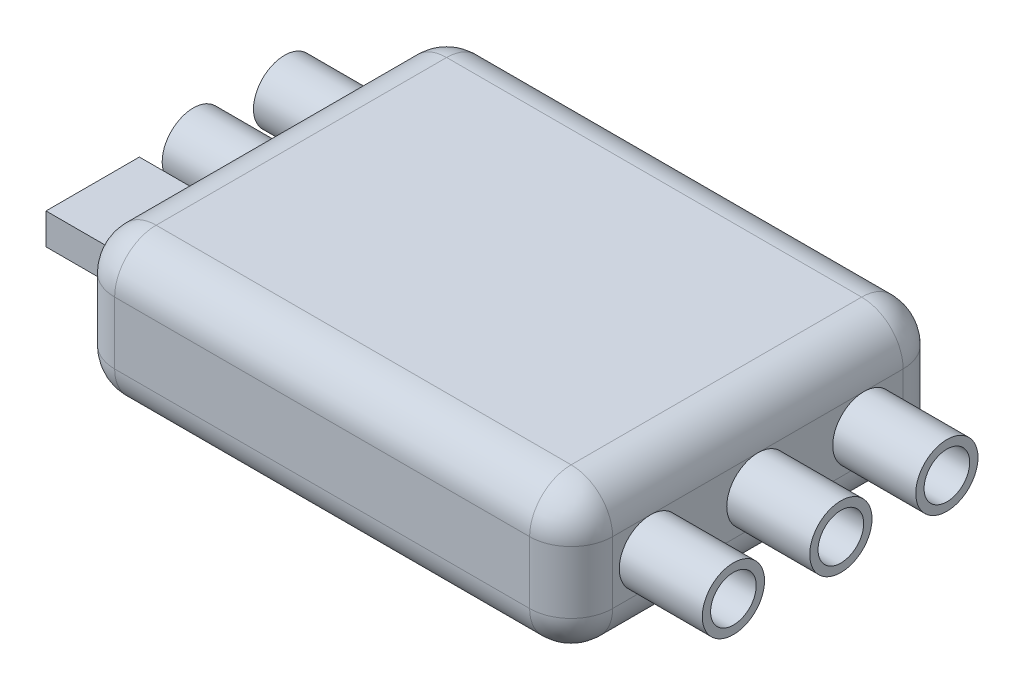
from build123d import *

# Parameters (mm, degrees)
BOSS_EXTRUDE1_DEPTH = 7
FILLET1_R           = 2
SKETCH2_R           = 1.5
SKETCH2_R_2         = 1.1
BOSS_EXTRUDE2_DEPTH = 4
SKETCH3_R           = 1.5
SKETCH3_R_2         = 1.1
SKETCH3_W           = 4.5
SKETCH3_H           = 1.5
BOSS_EXTRUDE3_DEPTH = 4


with BuildPart() as part:
    # Sketch1 → Boss-Extrude1 (new body)
    with BuildSketch(Plane(origin=(0, 0, 0), x_dir=(1, 0, 0), z_dir=(0, 1, 0))):
        with BuildLine():
            Line((-10, 9), (10, 9))
            ThreePointArc((10, 9), (11.414213562, 8.414213562), (12, 7))
            Line((12, 7), (12, -7))
            ThreePointArc((12, -7), (11.414213562, -8.414213562), (10, -9))
            Line((10, -9), (-10, -9))
            ThreePointArc((-10, -9), (-11.414213562, -8.414213562), (-12, -7))
            Line((-12, -7), (-12, 7))
            ThreePointArc((-12, 7), (-11.414213562, 8.414213562), (-10, 9))
        make_face()
    extrude(amount=BOSS_EXTRUDE1_DEPTH)

    # Fillet1
    fillet1_edges = [part.edges().sort_by_distance(p)[0] for p in [
        (12, 0, 0),
        (11.414213562, 0, 8.414213562),
        (0, 0, 9),
        (-11.414213562, 0, 8.414213562),
        (11.414213562, 7, 8.414213562),
        (12, 7, 0),
        (11.414213562, 7, -8.414213562),
        (0, 7, -9),
        (-11.414213562, 7, -8.414213562),
        (-12, 7, 0),
        (-11.414213562, 7, 8.414213562),
        (-12, 0, 0),
        (0, 7, 9),
        (-11.414213562, 0, -8.414213562),
        (0, 0, -9),
        (11.414213562, 0, -8.414213562),
    ]]
    fillet(fillet1_edges, radius=FILLET1_R)

    # Sketch2 → Boss-Extrude2 (add)
    # profile 1 of 3: a face of its own
    with BuildSketch(Plane(origin=(12, 0, 0), x_dir=(0, 0, -1), z_dir=(1, 0, 0))):
        with Locations(Location((0, 3.5, 0), (0, 0, 270))):
            Circle(SKETCH2_R)
        with Locations((0, 3.5)):
            Circle(SKETCH2_R_2, mode=Mode.SUBTRACT)
    # profile 2 of 3: a face of its own
    with BuildSketch(Plane(origin=(12, 0, 0), x_dir=(0, 0, -1), z_dir=(1, 0, 0))):
        with Locations(Location((-5.179100851, 3.5, 0), (0, 0, 270))):
            Circle(SKETCH2_R)
        with Locations((-5.179100851, 3.5)):
            Circle(SKETCH2_R_2, mode=Mode.SUBTRACT)
    # profile 3 of 3: a face of its own
    with BuildSketch(Plane(origin=(12, 0, 0), x_dir=(0, 0, -1), z_dir=(1, 0, 0))):
        with Locations(Location((5.109113001, 3.5, 0), (0, 0, 270))):
            Circle(SKETCH2_R)
        with Locations((5.109113001, 3.5)):
            Circle(SKETCH2_R_2, mode=Mode.SUBTRACT)
    extrude(amount=BOSS_EXTRUDE2_DEPTH)

    # Sketch3 → Boss-Extrude3 (add)
    # profile 1 of 3: a face of its own
    with BuildSketch(Plane.ZY.offset(12)):
        with Locations(Location((-5.190765492, 3.5, 0), (0, 0, 270))):
            Circle(SKETCH3_R)
        with Locations((-5.190765492, 3.5)):
            Circle(SKETCH3_R_2, mode=Mode.SUBTRACT)
    # profile 2 of 3: a face of its own
    with BuildSketch(Plane.ZY.offset(12)):
        with Locations(Location((-0.790765492, 3.5, 0), (0, 0, 270))):
            Circle(SKETCH3_R)
        with Locations((-0.790765492, 3.5)):
            Circle(SKETCH3_R_2, mode=Mode.SUBTRACT)
    # profile 3 of 3: a face of its own
    with BuildSketch(Plane.ZY.offset(12)):
        with Locations((4.058019441, 3.5)):
            Rectangle(SKETCH3_W, SKETCH3_H)
    extrude(amount=BOSS_EXTRUDE3_DEPTH)


solid = part.part
